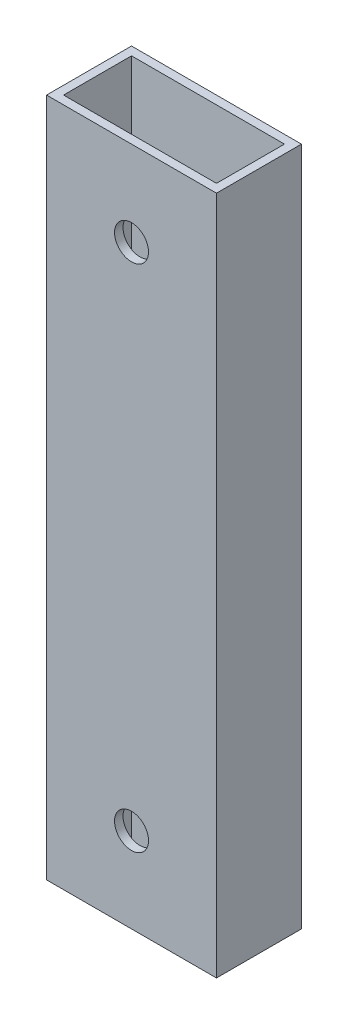
from build123d import *

# Parameters (mm, degrees)
SKETCH_1_W            = 20
SKETCH_1_H            = 10
SKETCH_1_W_2          = 18
SKETCH_1_H_2          = 8
EXTRUDE_1_DEPTH       = 80
HOLE_WIZARD_4_0_4_1_D = 4


with BuildPart() as part:
    # 草图1 → 凸台-拉伸1 (new body)
    with BuildSketch(Plane(origin=(0, 0, 0), x_dir=(1, 0, 0), z_dir=(0, 1, 0))):
        Rectangle(SKETCH_1_W, SKETCH_1_H)
        Rectangle(SKETCH_1_W_2, SKETCH_1_H_2, mode=Mode.SUBTRACT)
    extrude(amount=EXTRUDE_1_DEPTH)

    # Ø4.0 (4) 直径孔1 (through all)
    with Locations(Plane(origin=(0, 0, -5), x_dir=(-1, 0, 0), z_dir=(0, 0, -1))):
        with Locations((0, 10), (0, 70)):
            Hole(HOLE_WIZARD_4_0_4_1_D / 2)


solid = part.part
